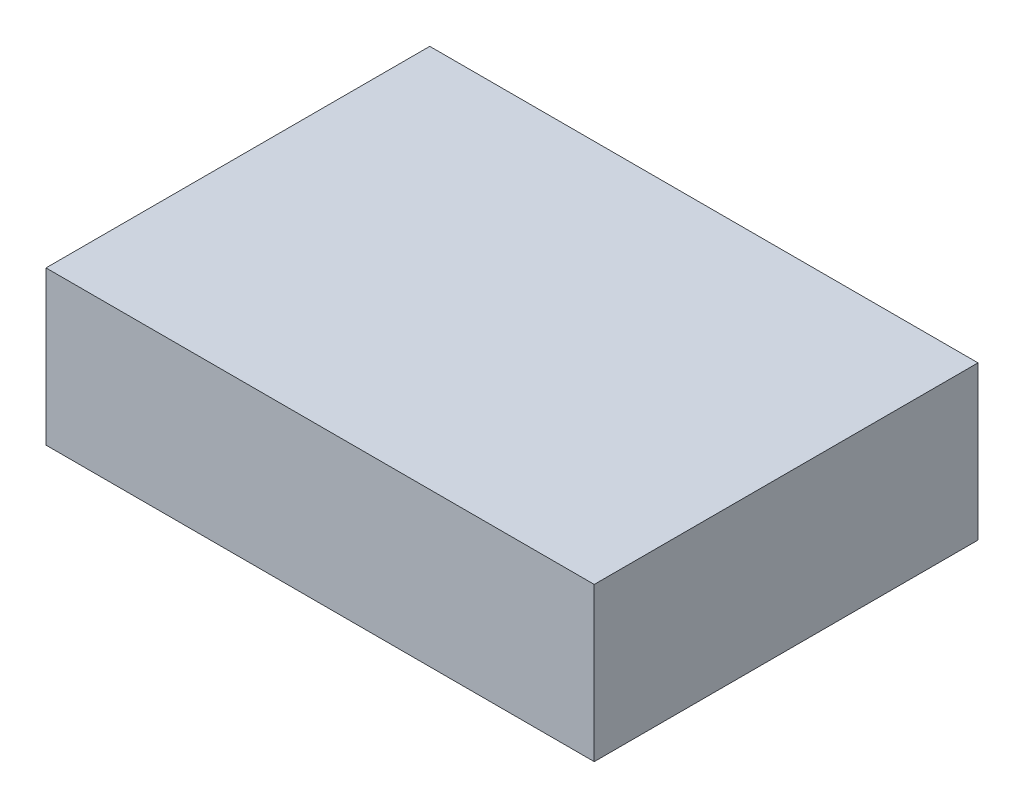
from build123d import *

# Parameters (mm, degrees)
SKETCH1_W           = 100
SKETCH1_H           = 70
BOSS_EXTRUDE1_DEPTH = 28


with BuildPart() as part:
    # Sketch1 → Boss-Extrude1 (new body)
    with BuildSketch(Plane(origin=(0, 0, 0), x_dir=(1, 0, 0), z_dir=(0, 1, 0))):
        with Locations((50, -35)):
            Rectangle(SKETCH1_W, SKETCH1_H)
    extrude(amount=BOSS_EXTRUDE1_DEPTH)


solid = part.part
